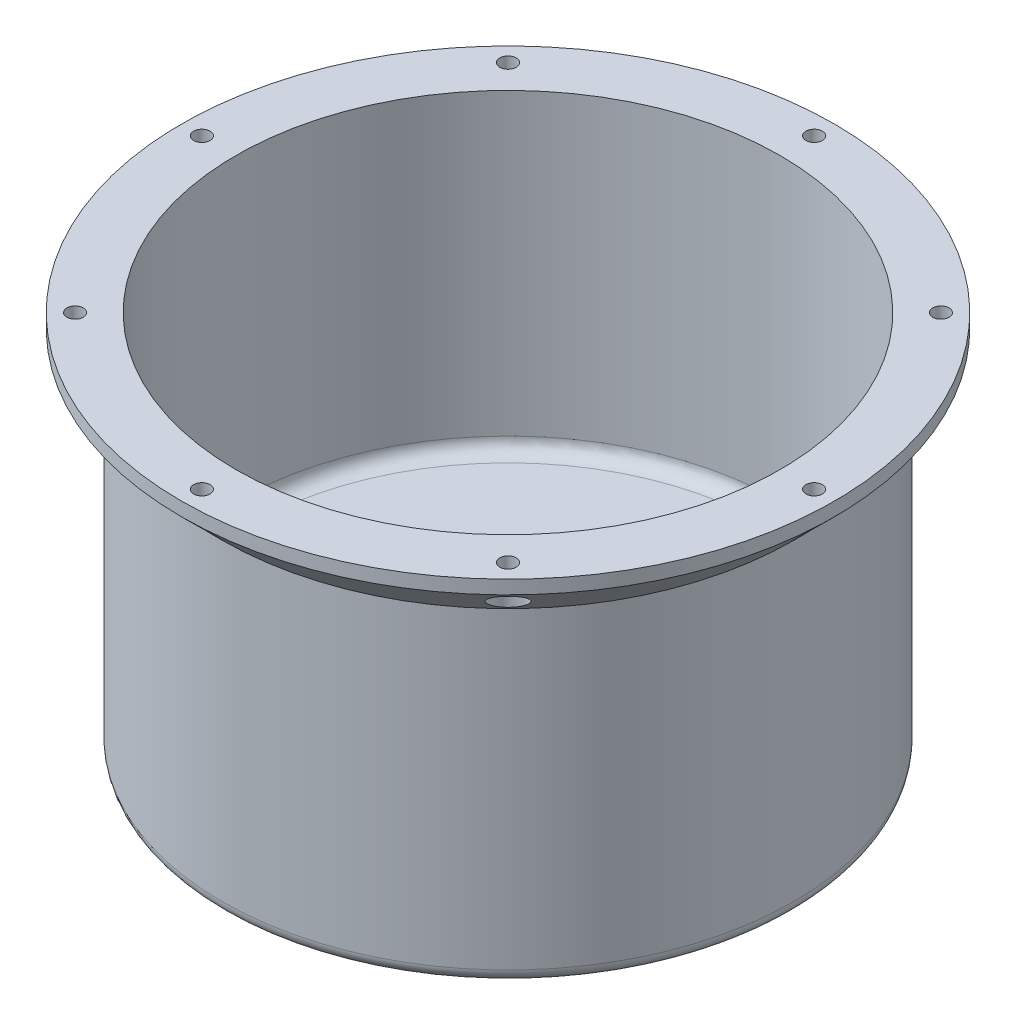
from build123d import *

# Parameters (mm, degrees)
SKETCH3_R          = 3
CUT_EXTRUDE1_DEPTH = 221
CUT_EXTRUDE2_START = -5
SKETCH3_3_R        = 6
SKETCH3_3_R_2      = 3
CUT_EXTRUDE2_DEPTH = 216.000000109
CIRPATTERN1_COUNT  = 8
FILLET2_R          = 5


with BuildPart() as part:
    # Sketch1 → Revolve1 (revolve)
    with BuildSketch(Plane.XY):
        Polygon((0, 0), (-10, 0), (-10, -20), (-105, -20), (-105, 0), (-105, 100), (-120, 115), (-120, 120), (-100, 120), (-100, 5), (0, 5), align=None)
    revolve(axis=Axis((0, 0, 0), (0, 1, 0)))

    # Sketch3 → Cut-Extrude1 (cut, symmetric)
    with BuildSketch(Plane(origin=(0, 120, 0), x_dir=(1, 0, 0), z_dir=(0, 1, 0))):
        with Locations((0, 112.5)):
            Circle(SKETCH3_R)
    cut_extrude1 = extrude(amount=CUT_EXTRUDE1_DEPTH, both=True, mode=Mode.SUBTRACT)

    # Sketch3<3> → Cut-Extrude2 (cut, through all)
    with BuildSketch(Plane(origin=(0, 120, 0), x_dir=(1, 0, 0), z_dir=(0, 1, 0)).offset(CUT_EXTRUDE2_START)):
        with Locations((0, 112.5)):
            Circle(SKETCH3_3_R)
        with Locations((0, 112.5)):
            Circle(SKETCH3_3_R_2, mode=Mode.SUBTRACT)
    cut_extrude2 = extrude(amount=-CUT_EXTRUDE2_DEPTH, mode=Mode.SUBTRACT)

    # CirPattern1: Cut-Extrude1, Cut-Extrude2 ×8 about axis
    cirpattern1_axis = Axis((0, 120, 0), (0, -1, 0))
    add([cut_extrude1.rotate(cirpattern1_axis, i * 360 / CIRPATTERN1_COUNT) for i in range(1, CIRPATTERN1_COUNT)], mode=Mode.SUBTRACT)
    add([cut_extrude2.rotate(cirpattern1_axis, i * 360 / CIRPATTERN1_COUNT) for i in range(1, CIRPATTERN1_COUNT)], mode=Mode.SUBTRACT)

    # Fillet2
    fillet2_edges = [part.edges().sort_by_distance(p)[0] for p in [
        (100, 5, 0),
        (105, -20, 0),
    ]]
    fillet(fillet2_edges, radius=FILLET2_R)


solid = part.part
